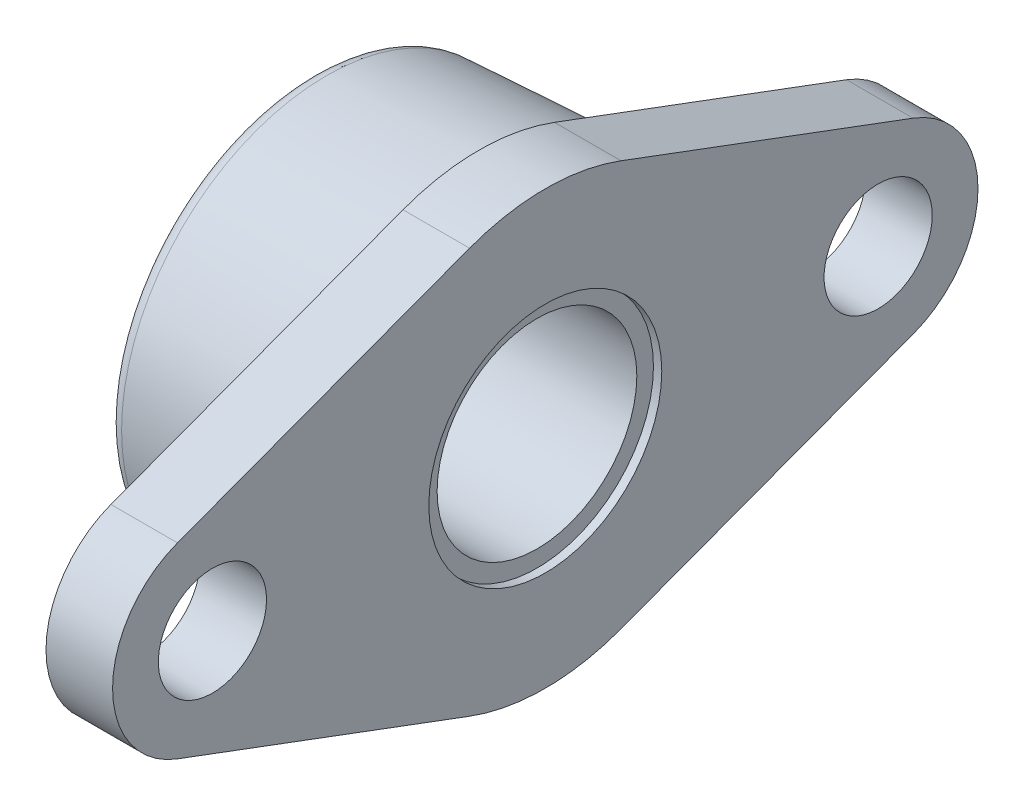
from build123d import *

# Parameters (mm, degrees)
SKETCH1_R           = 5.159375
BASE_EXTRUDE_DEPTH  = 6.35
SKETCH2_R           = 20.6375
BOSS_EXTRUDE1_DEPTH = 22.225
BOSS_EXTRUDE1_TAPER = 3
SKETCH3_R           = 9.525
CUT_EXTRUDE1_DEPTH  = 52.219943931
SKETCH4_R           = 11.1125
SKETCH4_R_2         = 9.525
BOSS_EXTRUDE2_DEPTH = 0.0254
BOSS_EXTRUDE2_DRAFT = 15
SKETCH5_R           = 11.1125
CUT_EXTRUDE2_DEPTH  = 0.79375
FILLET1_R           = 1.42875


with BuildPart() as part:
    # Sketch1 → Base-Extrude (new body)
    with BuildSketch(Plane(origin=(0, 0, 0), x_dir=(0, 0, -1), z_dir=(1, 0, 0))):
        with BuildLine():
            Line((-7.223125, -19.332171929), (-35.08375, -8.92254089))
            ThreePointArc((-35.08375, -8.92254089), (-41.275, 0), (-35.08375, 8.92254089))
            Line((-35.08375, 8.92254089), (-7.223125, 19.332171929))
            ThreePointArc((-7.223125, 19.332171929), (0, 20.6375), (7.223125, 19.332171929))
            Line((7.223125, 19.332171929), (35.08375, 8.92254089))
            ThreePointArc((35.08375, 8.92254089), (41.275, 0), (35.08375, -8.92254089))
            Line((35.08375, -8.92254089), (7.223125, -19.332171929))
            ThreePointArc((7.223125, -19.332171929), (0, -20.6375), (-7.223125, -19.332171929))
        make_face()
        with Locations((-31.75, 0)):
            Circle(SKETCH1_R, mode=Mode.SUBTRACT)
        with Locations((31.75, 0)):
            Circle(SKETCH1_R, mode=Mode.SUBTRACT)
    extrude(amount=-BASE_EXTRUDE_DEPTH)

    # Sketch2 → Boss-Extrude1 (add)
    with BuildSketch(Plane.ZY):
        Circle(SKETCH2_R)
    extrude(amount=BOSS_EXTRUDE1_DEPTH, taper=BOSS_EXTRUDE1_TAPER)

    # Sketch3 → Cut-Extrude1 (cut, through all)
    with BuildSketch(Plane.ZY.offset(22.225)):
        Circle(SKETCH3_R)
    extrude(amount=-CUT_EXTRUDE1_DEPTH, mode=Mode.SUBTRACT)


with BuildPart() as boss_extrude2_tool:
    # Sketch4 → Boss-Extrude2 (with draft: the straight prism first)
    with BuildSketch(Plane.ZY.offset(22.225)):
        Circle(SKETCH4_R)
        Circle(SKETCH4_R_2, mode=Mode.SUBTRACT)
    extrude(amount=BOSS_EXTRUDE2_DEPTH)
    # Boss-Extrude2: the draft: its side faces are tilted about the plane it starts from
    boss_extrude2_sides = [boss_extrude2_tool.faces().sort_by_distance(p)[0] for p in [
        (-22.2377, 0, -11.1125),
        (-22.2377, 0, -9.525),
    ]]
    draft(boss_extrude2_sides, Plane.ZY.offset(22.225), BOSS_EXTRUDE2_DRAFT)


with BuildPart() as part_1:
    add(part.part)

    # Boss-Extrude2: add boss_extrude2_tool
    add(boss_extrude2_tool.part)

    # Sketch5 → Cut-Extrude2 (cut)
    with BuildSketch(Plane(origin=(0, 0, 0), x_dir=(0, 0, -1), z_dir=(1, 0, 0))):
        Circle(SKETCH5_R)
    extrude(amount=-CUT_EXTRUDE2_DEPTH, mode=Mode.SUBTRACT)

    # Fillet1
    fillet1_edges = [part_1.edges().sort_by_distance(p)[0] for p in [
        (-22.225, 0, -19.472737105),
    ]]
    fillet(fillet1_edges, radius=FILLET1_R)


solid = part_1.part
